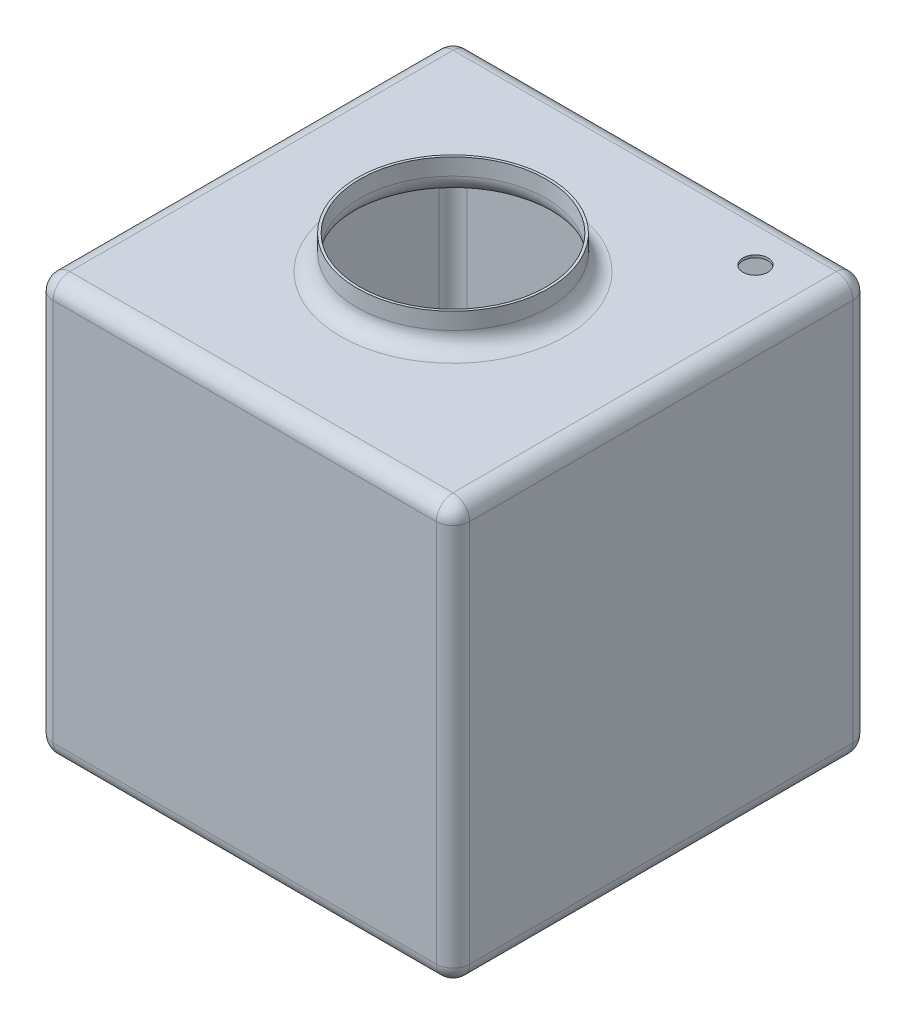
from build123d import *

# Parameters (mm, degrees)
CROQUIS1_W     = 500
CROQUIS1_H     = 500
EXTRUIR1_DEPTH = 500
CROQUIS2_R     = 115
EXTRUIR2_DEPTH = 40
REDONDEO1_R    = 20
VACIADO1_T     = -3
CROQUIS3_R     = 15
EXTRUIR3_DEPTH = 30


with BuildPart() as part:
    # Croquis1 → Extruir1 (new body)
    with BuildSketch(Plane(origin=(0, 0, 0), x_dir=(1, 0, 0), z_dir=(0, 1, 0))):
        Rectangle(CROQUIS1_W, CROQUIS1_H)
    extrude(amount=EXTRUIR1_DEPTH)

    # Croquis2 → Extruir2 (add)
    with BuildSketch(Plane(origin=(0, 500, 0), x_dir=(1, 0, 0), z_dir=(0, 1, 0))):
        with Locations(Location((0, 0, 0), (0, 0, 270))):
            Circle(CROQUIS2_R)
    extrude(amount=EXTRUIR2_DEPTH)

    # Redondeo1
    redondeo1_edges = [part.edges().sort_by_distance(p)[0] for p in [
        (250, 500, 0),
        (0, 500, -250),
        (0, 500, -115),
        (-250, 500, 0),
        (0, 0, -250),
        (250, 0, 0),
        (0, 0, 250),
        (-250, 0, 0),
        (0, 500, 250),
        (-250, 250, -250),
        (250, 250, -250),
        (250, 250, 250),
        (-250, 250, 250),
    ]]
    fillet(redondeo1_edges, radius=REDONDEO1_R)

    # Vaciado1
    vaciado1_openings = [part.faces().sort_by_distance(p)[0] for p in [
        (0, 540, 0),
    ]]
    offset(amount=VACIADO1_T, openings=vaciado1_openings, kind=Kind.INTERSECTION)

    # Croquis3 → Extruir3 (cut)
    with BuildSketch(Plane(origin=(0, 500, 0), x_dir=(1, 0, 0), z_dir=(0, 1, 0))):
        with Locations(Location((174.828263658, 188.220904974, 0), (0, 0, 270))):
            Circle(CROQUIS3_R)
    extrude(amount=-EXTRUIR3_DEPTH, mode=Mode.SUBTRACT)


solid = part.part
